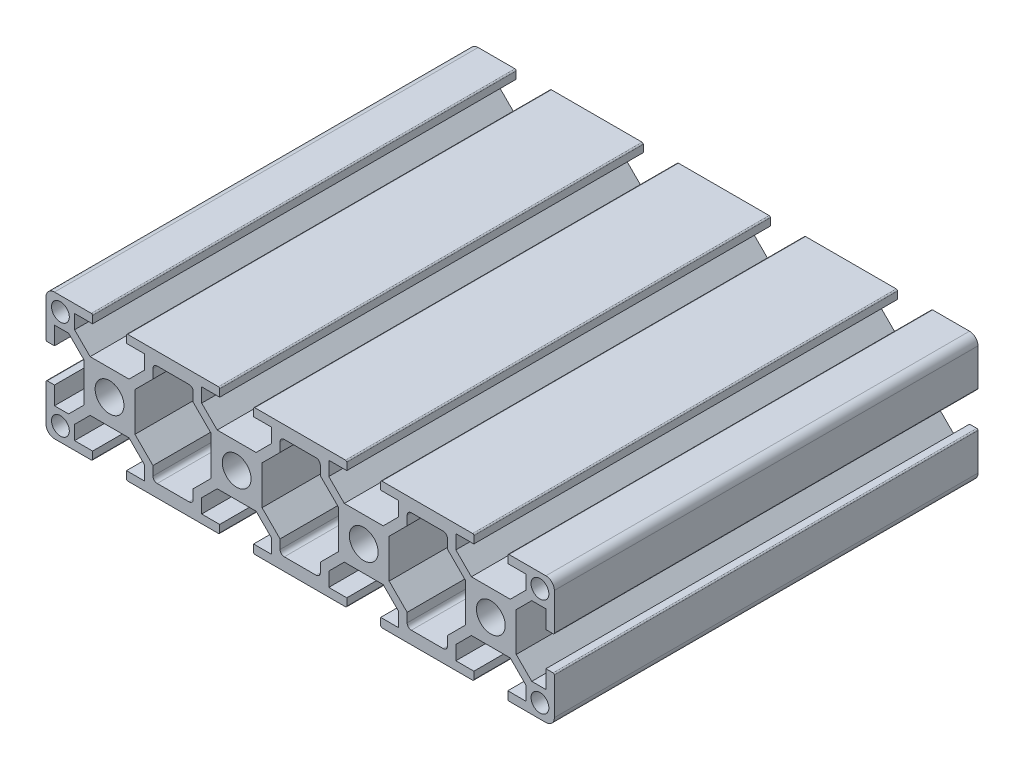
from build123d import *

# Parameters (mm, degrees)
SKETCH_1_R      = 3.4
SKETCH_1_R_2    = 2.1
EXTRUDE_1_DEPTH = 100


with BuildPart() as part:
    # 草图1 → 凸台-拉伸1 (new body)
    with BuildSketch(Plane.XY):
        with BuildLine():
            Line((-15, 13), (-15, 4.3))
            ThreePointArc((-15, 4.3), (-14.912132034, 4.087867966), (-14.7, 4))
            Line((-14.7, 4), (-13, 4))
            Line((-13, 4), (-13, 8.25))
            Line((-13, 8.25), (-9.664213562, 8.25))
            Line((-9.664213562, 8.25), (-6, 4.585786438))
            Line((-6, 4.585786438), (-6, -4.585786438))
            Line((-6, -4.585786438), (-9.664213562, -8.25))
            Line((-9.664213562, -8.25), (-13, -8.25))
            Line((-13, -8.25), (-13, -4))
            Line((-13, -4), (-14.7, -4))
            ThreePointArc((-14.7, -4), (-14.912132034, -4.087867966), (-15, -4.3))
            Line((-15, -4.3), (-15, -13))
            ThreePointArc((-15, -13), (-14.414213562, -14.414213562), (-13, -15))
            Line((-13, -15), (-4.3, -15))
            ThreePointArc((-4.3, -15), (-4.087867966, -14.912132034), (-4, -14.7))
            Line((-4, -14.7), (-4, -13))
            Line((-4, -13), (-8.25, -13))
            Line((-8.25, -13), (-8.25, -9.664213562))
            Line((-8.25, -9.664213562), (-4.585786438, -6))
            Line((-4.585786438, -6), (4.585786438, -6))
            Line((4.585786438, -6), (8.25, -9.664213562))
            Line((8.25, -9.664213562), (8.25, -13))
            Line((8.25, -13), (4, -13))
            Line((4, -13), (4, -14.7))
            ThreePointArc((4, -14.7), (4.087867966, -14.912132034), (4.3, -15))
            Line((4.3, -15), (25.7, -15))
            ThreePointArc((25.7, -15), (25.912132034, -14.912132034), (26, -14.7))
            Line((26, -14.7), (26, -13))
            Line((26, -13), (21.75, -13))
            Line((21.75, -13), (21.75, -9.664213562))
            Line((21.75, -9.664213562), (25.414213562, -6))
            Line((25.414213562, -6), (34.585786438, -6))
            Line((34.585786438, -6), (38.25, -9.664213562))
            Line((38.25, -9.664213562), (38.25, -13))
            Line((38.25, -13), (34, -13))
            Line((34, -13), (34, -14.7))
            ThreePointArc((34, -14.7), (34.087867966, -14.912132034), (34.3, -15))
            Line((34.3, -15), (55.7, -15))
            ThreePointArc((55.7, -15), (55.912132034, -14.912132034), (56, -14.7))
            Line((56, -14.7), (56, -13))
            Line((56, -13), (51.75, -13))
            Line((51.75, -13), (51.75, -9.664213562))
            Line((51.75, -9.664213562), (55.414213562, -6))
            Line((55.414213562, -6), (64.585786438, -6))
            Line((64.585786438, -6), (68.25, -9.664213562))
            Line((68.25, -9.664213562), (68.25, -13))
            Line((68.25, -13), (64, -13))
            Line((64, -13), (64, -14.7))
            ThreePointArc((64, -14.7), (64.087867966, -14.912132034), (64.3, -15))
            Line((64.3, -15), (85.7, -15))
            ThreePointArc((85.7, -15), (85.912132034, -14.912132034), (86, -14.7))
            Line((86, -14.7), (86, -13))
            Line((86, -13), (81.75, -13))
            Line((81.75, -13), (81.75, -9.664213562))
            Line((81.75, -9.664213562), (85.414213562, -6))
            Line((85.414213562, -6), (94.585786438, -6))
            Line((94.585786438, -6), (98.25, -9.664213562))
            Line((98.25, -9.664213562), (98.25, -13))
            Line((98.25, -13), (94, -13))
            Line((94, -13), (94, -14.7))
            ThreePointArc((94, -14.7), (94.087867966, -14.912132034), (94.3, -15))
            Line((94.3, -15), (103, -15))
            ThreePointArc((103, -15), (104.414213562, -14.414213562), (105, -13))
            Line((105, -13), (105, -4.3))
            ThreePointArc((105, -4.3), (104.912132034, -4.087867966), (104.7, -4))
            Line((104.7, -4), (103, -4))
            Line((103, -4), (103, -8.25))
            Line((103, -8.25), (99.664213562, -8.25))
            Line((99.664213562, -8.25), (96, -4.585786438))
            Line((96, -4.585786438), (96, 4.585786438))
            Line((96, 4.585786438), (99.664213562, 8.25))
            Line((99.664213562, 8.25), (103, 8.25))
            Line((103, 8.25), (103, 4))
            Line((103, 4), (104.7, 4))
            ThreePointArc((104.7, 4), (104.912132034, 4.087867966), (105, 4.3))
            Line((105, 4.3), (105, 13))
            ThreePointArc((105, 13), (104.414213562, 14.414213562), (103, 15))
            Line((103, 15), (94.3, 15))
            ThreePointArc((94.3, 15), (94.087867966, 14.912132034), (94, 14.7))
            Line((94, 14.7), (94, 13))
            Line((94, 13), (98.25, 13))
            Line((98.25, 13), (98.25, 9.664213562))
            Line((98.25, 9.664213562), (94.585786438, 6))
            Line((94.585786438, 6), (85.414213562, 6))
            Line((85.414213562, 6), (81.75, 9.664213562))
            Line((81.75, 9.664213562), (81.75, 13))
            Line((81.75, 13), (86, 13))
            Line((86, 13), (86, 14.7))
            ThreePointArc((86, 14.7), (85.912132034, 14.912132034), (85.7, 15))
            Line((85.7, 15), (64.3, 15))
            ThreePointArc((64.3, 15), (64.087867966, 14.912132034), (64, 14.7))
            Line((64, 14.7), (64, 13))
            Line((64, 13), (68.25, 13))
            Line((68.25, 13), (68.25, 9.664213562))
            Line((68.25, 9.664213562), (64.585786438, 6))
            Line((64.585786438, 6), (55.414213562, 6))
            Line((55.414213562, 6), (51.75, 9.664213562))
            Line((51.75, 9.664213562), (51.75, 13))
            Line((51.75, 13), (56, 13))
            Line((56, 13), (56, 14.7))
            ThreePointArc((56, 14.7), (55.912132034, 14.912132034), (55.7, 15))
            Line((55.7, 15), (34.3, 15))
            ThreePointArc((34.3, 15), (34.087867966, 14.912132034), (34, 14.7))
            Line((34, 14.7), (34, 13))
            Line((34, 13), (38.25, 13))
            Line((38.25, 13), (38.25, 9.664213562))
            Line((38.25, 9.664213562), (34.585786438, 6))
            Line((34.585786438, 6), (25.414213562, 6))
            Line((25.414213562, 6), (21.75, 9.664213562))
            Line((21.75, 9.664213562), (21.75, 13))
            Line((21.75, 13), (26, 13))
            Line((26, 13), (26, 14.7))
            ThreePointArc((26, 14.7), (25.912132034, 14.912132034), (25.7, 15))
            Line((25.7, 15), (4.3, 15))
            ThreePointArc((4.3, 15), (4.087867966, 14.912132034), (4, 14.7))
            Line((4, 14.7), (4, 13))
            Line((4, 13), (8.25, 13))
            Line((8.25, 13), (8.25, 9.664213562))
            Line((8.25, 9.664213562), (4.585786438, 6))
            Line((4.585786438, 6), (-4.585786438, 6))
            Line((-4.585786438, 6), (-8.25, 9.664213562))
            Line((-8.25, 9.664213562), (-8.25, 13))
            Line((-8.25, 13), (-4, 13))
            Line((-4, 13), (-4, 14.7))
            ThreePointArc((-4, 14.7), (-4.087867966, 14.912132034), (-4.3, 15))
            Line((-4.3, 15), (-13, 15))
            ThreePointArc((-13, 15), (-14.414213562, 14.414213562), (-15, 13))
        make_face()
        with Locations((60, 0)):
            Circle(SKETCH_1_R, mode=Mode.SUBTRACT)
        with Locations((90, 0)):
            Circle(SKETCH_1_R, mode=Mode.SUBTRACT)
        with Locations((30, 0)):
            Circle(SKETCH_1_R, mode=Mode.SUBTRACT)
        Circle(SKETCH_1_R, mode=Mode.SUBTRACT)
        with Locations((101.6, 11.65)):
            Circle(SKETCH_1_R_2, mode=Mode.SUBTRACT)
        with Locations((101.6, -11.65)):
            Circle(SKETCH_1_R_2, mode=Mode.SUBTRACT)
        with Locations((-11.6, -11.65)):
            Circle(SKETCH_1_R_2, mode=Mode.SUBTRACT)
        with Locations((-11.6, 11.65)):
            Circle(SKETCH_1_R_2, mode=Mode.SUBTRACT)
        with BuildLine():
            Line((70.25, 11), (70.25, 10))
            Line((70.25, 10), (70.25, 8.835786438))
            Line((70.25, 8.835786438), (66, 4.585786438))
            Line((66, 4.585786438), (66, -4.585786438))
            Line((66, -4.585786438), (70.25, -8.835786438))
            Line((70.25, -8.835786438), (70.25, -10))
            Line((70.25, -10), (70.25, -11))
            ThreePointArc((70.25, -11), (70.542893219, -11.707106781), (71.25, -12))
            Line((71.25, -12), (78.75, -12))
            ThreePointArc((78.75, -12), (79.457106781, -11.707106781), (79.75, -11))
            Line((79.75, -11), (79.75, -10))
            Line((79.75, -10), (79.75, -8.835786438))
            Line((79.75, -8.835786438), (84, -4.585786438))
            Line((84, -4.585786438), (84, 4.585786438))
            Line((84, 4.585786438), (79.75, 8.835786438))
            Line((79.75, 8.835786438), (79.75, 10))
            Line((79.75, 10), (79.75, 11))
            ThreePointArc((79.75, 11), (79.457106781, 11.707106781), (78.75, 12))
            Line((78.75, 12), (71.25, 12))
            ThreePointArc((71.25, 12), (70.542893219, 11.707106781), (70.25, 11))
        make_face(mode=Mode.SUBTRACT)
        with BuildLine():
            Line((11.25, -12), (18.75, -12))
            ThreePointArc((18.75, -12), (19.457106781, -11.707106781), (19.75, -11))
            Line((19.75, -11), (19.75, -10))
            Line((19.75, -10), (19.75, -8.835786438))
            Line((19.75, -8.835786438), (24, -4.585786438))
            Line((24, -4.585786438), (24, 4.585786438))
            Line((24, 4.585786438), (19.75, 8.835786438))
            Line((19.75, 8.835786438), (19.75, 10))
            Line((19.75, 10), (19.75, 11))
            ThreePointArc((19.75, 11), (19.457106781, 11.707106781), (18.75, 12))
            Line((18.75, 12), (11.25, 12))
            ThreePointArc((11.25, 12), (10.542893219, 11.707106781), (10.25, 11))
            Line((10.25, 11), (10.25, 10))
            Line((10.25, 10), (10.25, 8.835786438))
            Line((10.25, 8.835786438), (6, 4.585786438))
            Line((6, 4.585786438), (6, -4.585786438))
            Line((6, -4.585786438), (10.25, -8.835786438))
            Line((10.25, -8.835786438), (10.25, -10))
            Line((10.25, -10), (10.25, -11))
            ThreePointArc((10.25, -11), (10.542893219, -11.707106781), (11.25, -12))
        make_face(mode=Mode.SUBTRACT)
        with BuildLine():
            Line((41.25, -12), (48.75, -12))
            ThreePointArc((48.75, -12), (49.457106781, -11.707106781), (49.75, -11))
            Line((49.75, -11), (49.75, -10))
            Line((49.75, -10), (49.75, -8.835786438))
            Line((49.75, -8.835786438), (54, -4.585786438))
            Line((54, -4.585786438), (54, 4.585786438))
            Line((54, 4.585786438), (49.75, 8.835786438))
            Line((49.75, 8.835786438), (49.75, 10))
            Line((49.75, 10), (49.75, 11))
            ThreePointArc((49.75, 11), (49.457106781, 11.707106781), (48.75, 12))
            Line((48.75, 12), (41.25, 12))
            ThreePointArc((41.25, 12), (40.542893219, 11.707106781), (40.25, 11))
            Line((40.25, 11), (40.25, 10))
            Line((40.25, 10), (40.25, 8.835786438))
            Line((40.25, 8.835786438), (36, 4.585786438))
            Line((36, 4.585786438), (36, -4.585786438))
            Line((36, -4.585786438), (40.25, -8.835786438))
            Line((40.25, -8.835786438), (40.25, -10))
            Line((40.25, -10), (40.25, -11))
            ThreePointArc((40.25, -11), (40.542893219, -11.707106781), (41.25, -12))
        make_face(mode=Mode.SUBTRACT)
    extrude(amount=EXTRUDE_1_DEPTH)


solid = part.part
